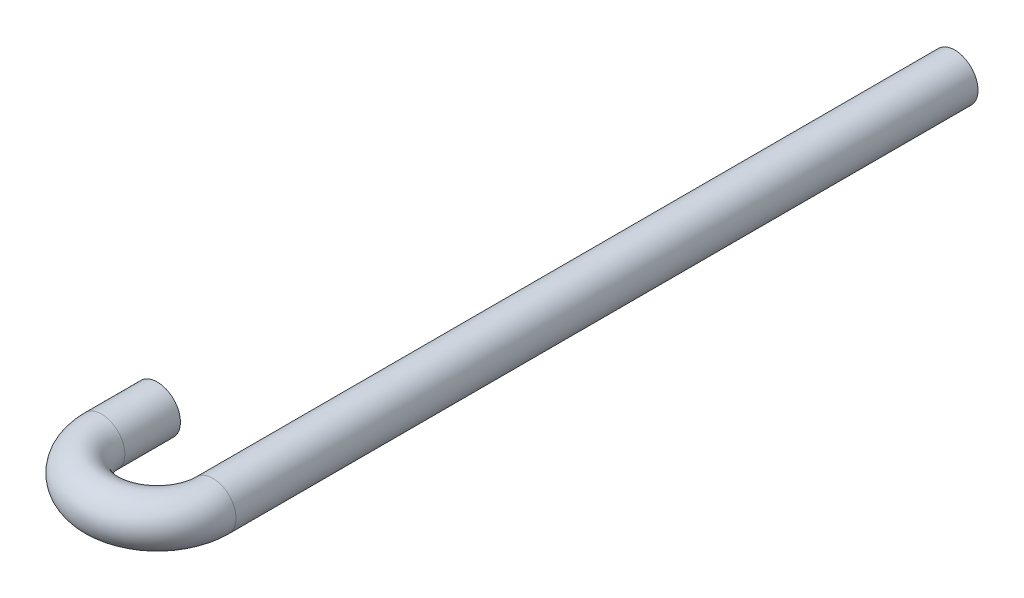
from build123d import *

# Parameters (mm, degrees)
SKETCH2_R           = 3.96875
BOSS_EXTRUDE1_DEPTH = 63.5
SKETCH3_R           = 3.96875


with BuildPart() as part:
    # Sketch2 → Boss-Extrude1 (new, symmetric)
    with BuildSketch(Plane.XY):
        with Locations((0, -50.8)):
            Circle(SKETCH2_R)
    extrude(amount=BOSS_EXTRUDE1_DEPTH, both=True)

    # Sweep1: sweep along a path in Sketch4
    with BuildLine(Plane(origin=(0, 0, 0), x_dir=(1, 0, 0), z_dir=(0, 1, 0))) as sweep1_path:
        Line((-19.05, -53.975), (-19.05, -63.5))
        ThreePointArc((-19.05, -63.5), (-9.525, -73.025), (0, -63.5))
    # Sketch3 → Sweep1 (sweep)
    with BuildSketch(Plane.XY.offset(63.5)):
        with Locations((0, -50.8)):
            Circle(SKETCH3_R)
    sweep(path=sweep1_path.line)


solid = part.part
